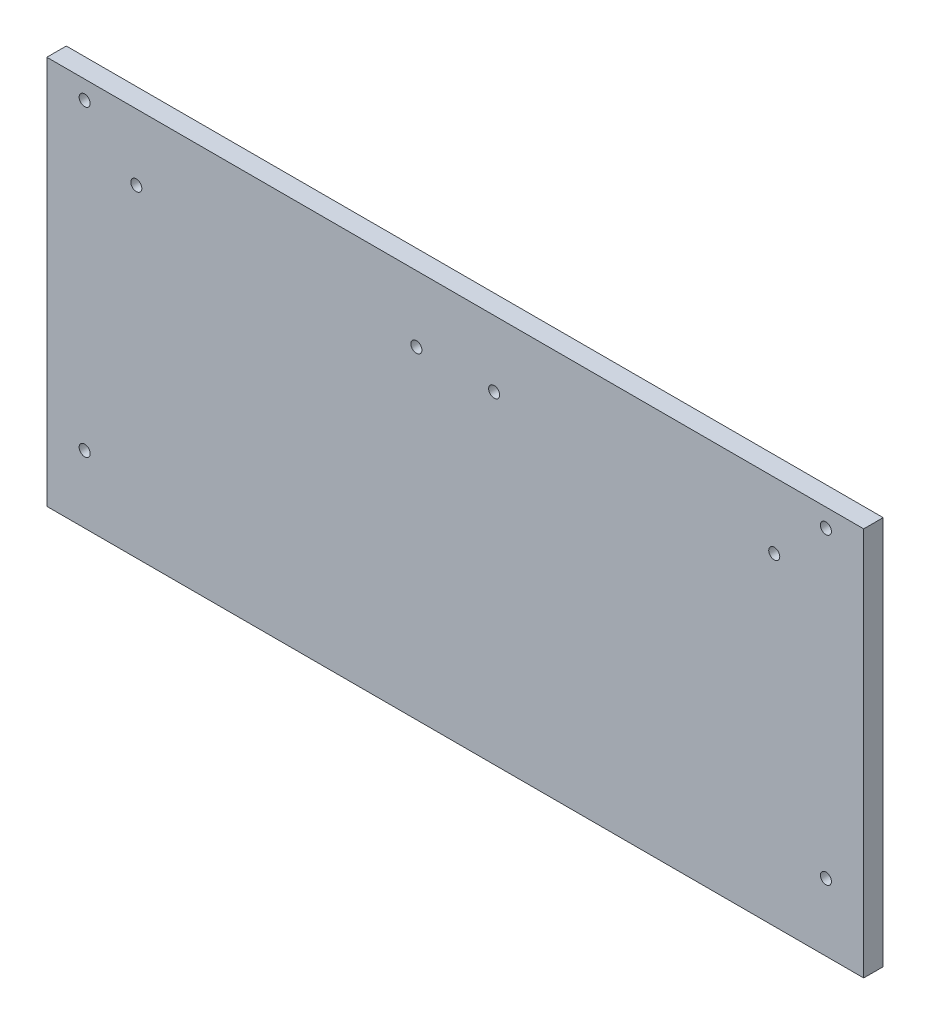
from build123d import *

# Parameters (mm, degrees)
SKETCH1_W            = 266.7
SKETCH1_H            = 127
BOSS_EXTRUDE1_DEPTH  = 6.35
M3_CLEARANCE_HOLE1_D = 3.6
M3_CLEARANCE_HOLE2_D = 3.6


with BuildPart() as part:
    # Sketch1 → Boss-Extrude1 (new body)
    with BuildSketch(Plane.XY):
        with Locations((133.35, 63.5)):
            Rectangle(SKETCH1_W, SKETCH1_H)
    extrude(amount=BOSS_EXTRUDE1_DEPTH)

    # M3 Clearance Hole1 (through all)
    with Locations(Plane.XY.offset(6.35)):
        with Locations((12.3444, 121.0056), (12.3444, 21.9964), (254.3556, 21.9964), (254.3556, 121.0056)):
            Hole(M3_CLEARANCE_HOLE1_D / 2)

    # M3 Clearance Hole2 (through all)
    with Locations(Plane.XY.offset(6.35)):
        with Locations((29.21, 105.41), (120.65, 105.41), (146.05, 105.41), (237.49, 105.41)):
            Hole(M3_CLEARANCE_HOLE2_D / 2)


solid = part.part
